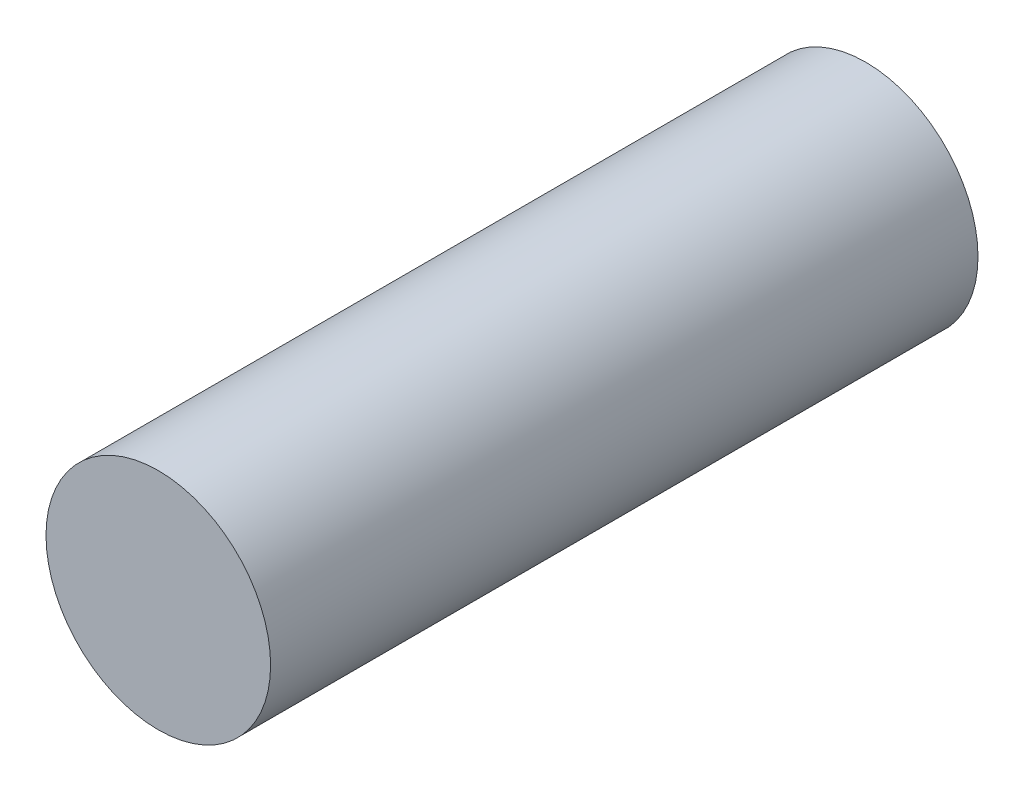
from build123d import *

# Parameters (mm, degrees)
SKETCH1_R           = 6.35
BOSS_EXTRUDE1_DEPTH = 40


with BuildPart() as part:
    # Sketch1 → Boss-Extrude1 (new body)
    with BuildSketch(Plane.XY):
        Circle(SKETCH1_R)
    extrude(amount=BOSS_EXTRUDE1_DEPTH)


solid = part.part
